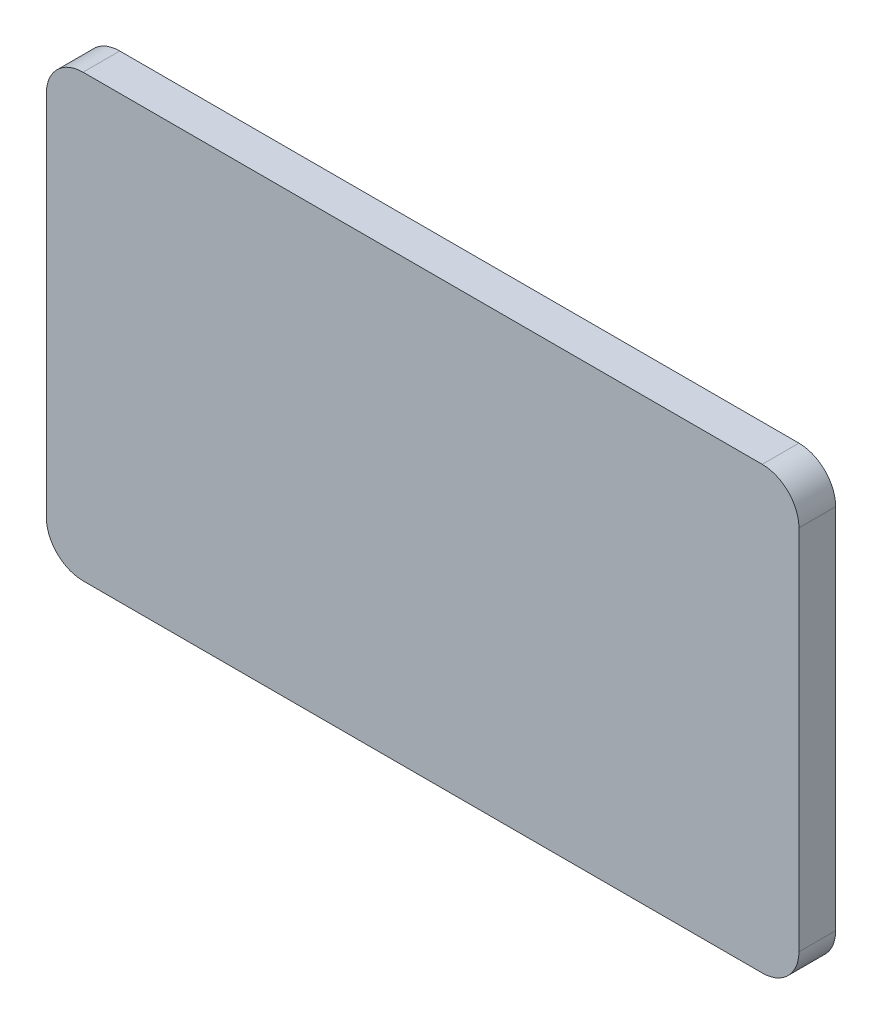
from build123d import *

# Parameters (mm, degrees)
SKETCH1_W           = 41
SKETCH1_H           = 24
BOSS_EXTRUDE1_DEPTH = 2
FILLET1_R           = 2


with BuildPart() as part:
    # Sketch1 → Boss-Extrude1 (new body)
    with BuildSketch(Plane.XY):
        with Locations((20.5, -12)):
            Rectangle(SKETCH1_W, SKETCH1_H)
    extrude(amount=BOSS_EXTRUDE1_DEPTH)

    # Fillet1
    fillet1_edges = [part.edges().sort_by_distance(p)[0] for p in [
        (0, 0, 1),
        (41, 0, 1),
        (41, -24, 1),
        (0, -24, 1),
    ]]
    fillet(fillet1_edges, radius=FILLET1_R)


solid = part.part
